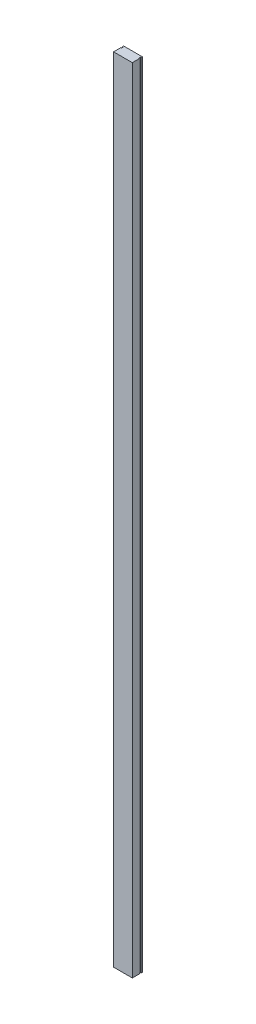
from build123d import *

# Parameters (mm, degrees)
EXTRUDE_1_DEPTH        = 550
SKETCH_3_R             = 3
CUT_EXTRUDE_2_DEPTH    = 5
SKETCH_4_R             = 2.5
EXTRUDE_2_DEPTH        = 3
PATTERN_LINEAR_1_COUNT = 9
PATTERN_LINEAR_1_PITCH = 63


with BuildPart() as part:
    # 草圖1 → 填料-伸長1 (new body)
    with BuildSketch(Plane(origin=(0, 0, 0), x_dir=(1, 0, 0), z_dir=(0, 1, 0))):
        Polygon((-6.5, 0), (6.5, 0), (6.5, 5), (6, 5), (6, 6), (6.5, 6), (6.5, 7), (-6.5, 7), (-6.5, 6), (-6, 6), (-6, 5), (-6.5, 5), align=None)
    extrude(amount=EXTRUDE_1_DEPTH)

    # 草圖3 → 除料-伸長2 (cut)
    with BuildSketch(Plane(origin=(0, 0, -7), x_dir=(-1, 0, 0), z_dir=(0, 0, -1))):
        with Locations((0, 540)):
            Circle(SKETCH_3_R)
    cut_extrude_2 = extrude(amount=-CUT_EXTRUDE_2_DEPTH, mode=Mode.SUBTRACT)

    # 草圖4 → 填料-伸長2 (add)
    with BuildSketch(Plane(origin=(0, 0, -2), x_dir=(-1, 0, 0), z_dir=(0, 0, -1))):
        with Locations((0, 540)):
            Circle(SKETCH_4_R)
        Polygon((1.732050808, 540), (0.866025404, 541.5), (-0.866025404, 541.5), (-1.732050808, 540), (-0.866025404, 538.5), (0.866025404, 538.5), align=None, mode=Mode.SUBTRACT)
    extrude_2 = extrude(amount=EXTRUDE_2_DEPTH)

    # 直線複製排列1: 除料-伸長2, 填料-伸長2 ×9
    with Locations(*[(0, -i * PATTERN_LINEAR_1_PITCH, 0) for i in range(1, PATTERN_LINEAR_1_COUNT)]):
        add(cut_extrude_2, mode=Mode.SUBTRACT)
        add(extrude_2)


solid = part.part
